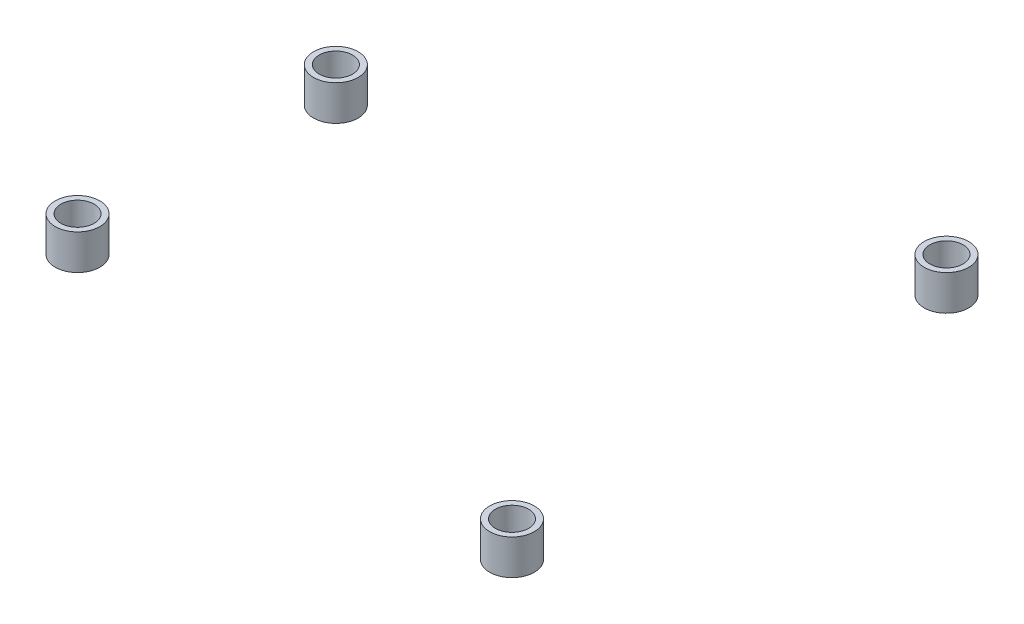
from build123d import *

# Parameters (mm, degrees)
SKETCH1_R             = 2.413
SKETCH1_R_2           = 1.8
BOSS_EXTRUDE1_DEPTH   = 3.81
BOSS_EXTRUDE1_2_DEPTH = 3.81
BOSS_EXTRUDE1_3_DEPTH = 3.81
BOSS_EXTRUDE1_4_DEPTH = 3.81


with BuildPart() as part:
    # Sketch1 → Boss-Extrude1 (new body)
    with BuildSketch(Plane(origin=(0, 0, 0), x_dir=(1, 0, 0), z_dir=(0, 1, 0))):
        with Locations(Location((-29.447979475, -17.789937656, 0), (0, 0, 270))):
            Circle(SKETCH1_R)
        with Locations(Location((-29.447979475, -17.789937656, 0), (0, 0, 270))):
            Circle(SKETCH1_R_2, mode=Mode.SUBTRACT)
    extrude(amount=-BOSS_EXTRUDE1_DEPTH)


with BuildPart() as body_2:
    # Sketch1 → Boss-Extrude1 2 (new body)
    with BuildSketch(Plane(origin=(0, 0, 0), x_dir=(1, 0, 0), z_dir=(0, 1, 0))):
        with Locations(Location((-29.447979475, 10.150062344, 0), (0, 0, 270))):
            Circle(SKETCH1_R)
        with Locations(Location((-29.447979475, 10.150062344, 0), (0, 0, 270))):
            Circle(SKETCH1_R_2, mode=Mode.SUBTRACT)
    extrude(amount=-BOSS_EXTRUDE1_2_DEPTH)


with BuildPart() as body_3:
    # Sketch1 → Boss-Extrude1 3 (new body)
    with BuildSketch(Plane(origin=(0, 0, 0), x_dir=(1, 0, 0), z_dir=(0, 1, 0))):
        with Locations(Location((21.352020525, 25.390062344, 0), (0, 0, 270))):
            Circle(SKETCH1_R)
        with Locations(Location((21.352020525, 25.390062344, 0), (0, 0, 270))):
            Circle(SKETCH1_R_2, mode=Mode.SUBTRACT)
    extrude(amount=-BOSS_EXTRUDE1_3_DEPTH)


with BuildPart() as body_4:
    # Sketch1 → Boss-Extrude1 4 (new body)
    with BuildSketch(Plane(origin=(0, 0, 0), x_dir=(1, 0, 0), z_dir=(0, 1, 0))):
        with Locations(Location((22.622020525, -22.869937656, 0), (0, 0, 270))):
            Circle(SKETCH1_R)
        with Locations(Location((22.622020525, -22.869937656, 0), (0, 0, 270))):
            Circle(SKETCH1_R_2, mode=Mode.SUBTRACT)
    extrude(amount=-BOSS_EXTRUDE1_4_DEPTH)


solid = Compound([part.part, body_2.part, body_3.part, body_4.part])
